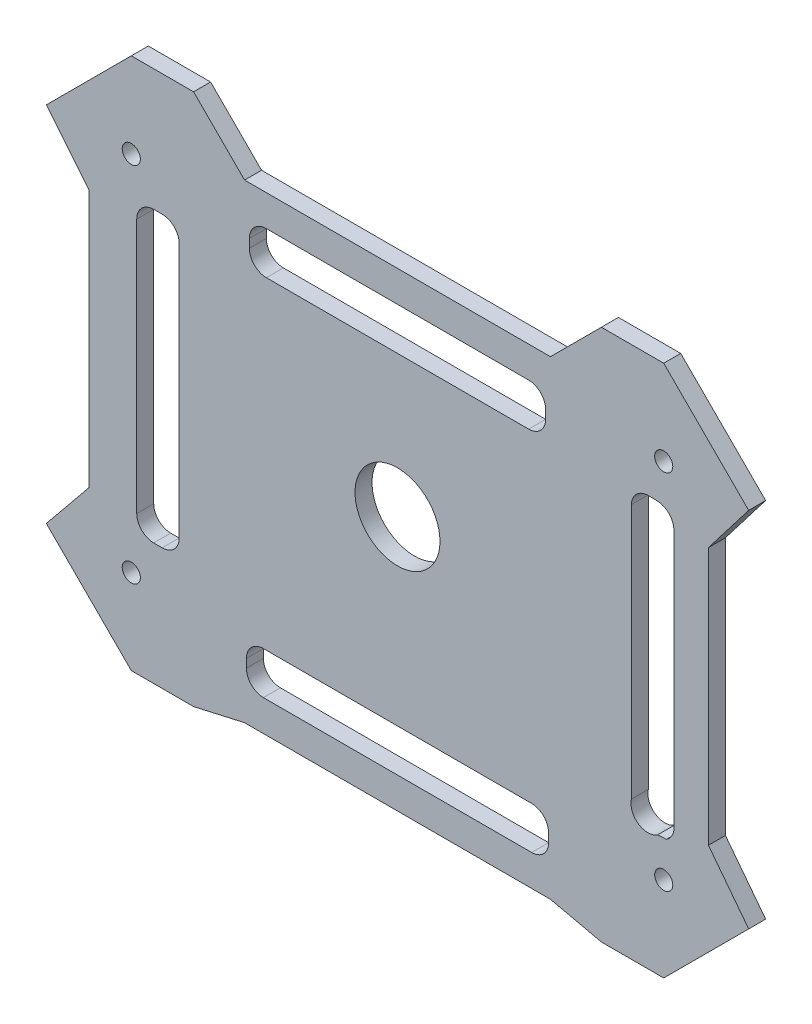
from build123d import *

# Parameters (mm, degrees)
SKETCH1_R           = 7.50000053
SKETCH1_R_2         = 1.6
BOSS_EXTRUDE1_DEPTH = 3


with BuildPart() as part:
    # Sketch1 → Boss-Extrude1 (new body)
    with BuildSketch(Plane.XY):
        Polygon((-66.89924788, 56.788402458), (-51.89924788, 71.788403422), (-40.89924788, 71.788403422), (-31.89924788, 62.788403422), (22.10075212, 62.788403422), (31.10075212, 71.788403422), (42.10075212, 71.788403422), (57.10075212, 56.788402458), (49.999134038, 47.546675265), (49.999134038, 2.030197685), (57.10075212, -7.211596578), (42.10075212, -22.211596578), (31.10075212, -22.211596578), (22.10075212, -20.180597469), (-31.89924788, -20.180597469), (-40.89924788, -22.211598699), (-51.89924788, -22.211598699), (-66.89924788, -7.211596578), (-59.371431864, 2.030197685), (-59.371431864, 47.546675265), align=None)
        with Locations((-4.89924788, 24.798725856)):
            Circle(SKETCH1_R, mode=Mode.SUBTRACT)
        with Locations((-51.89924788, 56.788403422)):
            Circle(SKETCH1_R_2, mode=Mode.SUBTRACT)
        with Locations((42.10075212, 56.788403422)):
            Circle(SKETCH1_R_2, mode=Mode.SUBTRACT)
        with Locations((42.10075212, -7.211596578)):
            Circle(SKETCH1_R_2, mode=Mode.SUBTRACT)
        with Locations((-51.89924788, -7.211596578)):
            Circle(SKETCH1_R_2, mode=Mode.SUBTRACT)
        with BuildLine():
            Line((-47.943404379, 50.293594248), (-46.443406464, 50.296157806))
            ThreePointArc((-46.443406464, 50.296157806), (-44.318775436, 49.419295137), (-43.438283518, 47.296165805))
            Line((-43.438283518, 47.296165805), (-43.438283518, 2.301285908))
            ThreePointArc((-43.438283518, 2.301285908), (-44.312414708, 0.171678429), (-46.438272777, -0.711532092))
            Line((-46.438272777, -0.711532092), (-47.938272883, -0.711532092))
            ThreePointArc((-47.938272883, -0.711532092), (-50.059593376, 0.167147627), (-50.938273095, 2.28846812))
            Line((-50.938273095, 2.28846812), (-50.938273095, 47.288471302))
            ThreePointArc((-50.938273095, 47.288471302), (-50.063220077, 49.411290395), (-47.943404379, 50.293594248))
        make_face(mode=Mode.SUBTRACT)
        with BuildLine():
            Line((-28.054738716, 57.288403953), (18.256242957, 57.288403953))
            ThreePointArc((18.256242957, 57.288403953), (20.377563451, 56.409724234), (21.256243169, 54.28840374))
            Line((21.256243169, 54.28840374), (21.256243169, 52.788403634))
            ThreePointArc((21.256243169, 52.788403634), (20.377563451, 50.667083141), (18.256242957, 49.788403422))
            Line((18.256242957, 49.788403422), (-28.054738716, 49.788403422))
            ThreePointArc((-28.054738716, 49.788403422), (-30.17605921, 50.667083141), (-31.054738929, 52.788403634))
            Line((-31.054738929, 52.788403634), (-31.054738929, 54.28840374))
            ThreePointArc((-31.054738929, 54.28840374), (-30.17605921, 56.409724234), (-28.054738716, 57.288403953))
        make_face(mode=Mode.SUBTRACT)
        with BuildLine():
            Line((40.986432116, 50.152198784), (39.487237783, 50.201358441))
            ThreePointArc((39.487237783, 50.201358441), (37.338259765, 49.392672987), (36.390529804, 47.30128909))
            Line((36.390529804, 47.30128909), (36.390529804, 2.296162622))
            ThreePointArc((36.390529804, 2.296162622), (37.63815416, -0.88414715), (41.054067708, -0.834433807))
            Line((41.054067708, -0.834433807), (42.553262041, -0.78527415))
            ThreePointArc((42.553262041, -0.78527415), (43.695191197, 0.55294834), (43.890530335, 2.301285908))
            Line((43.890530335, 2.301285908), (43.890530335, 47.30128909))
            ThreePointArc((43.890530335, 47.30128909), (42.995792019, 49.294452303), (40.986432116, 50.152198784))
        make_face(mode=Mode.SUBTRACT)
        with BuildLine():
            Line((18.778253795, -14.680597999), (-28.576749554, -14.680597999))
            ThreePointArc((-28.576749554, -14.680597999), (-30.698070048, -13.801918281), (-31.576749766, -11.680597787))
            Line((-31.576749766, -11.680597787), (-31.576749766, -10.180597681))
            ThreePointArc((-31.576749766, -10.180597681), (-30.698070048, -8.059277188), (-28.576749554, -7.180597469))
            Line((-28.576749554, -7.180597469), (18.778253795, -7.180597469))
            ThreePointArc((18.778253795, -7.180597469), (20.899574288, -8.059277188), (21.778254007, -10.180597681))
            Line((21.778254007, -10.180597681), (21.778254007, -11.680597787))
            ThreePointArc((21.778254007, -11.680597787), (20.899574288, -13.801918281), (18.778253795, -14.680597999))
        make_face(mode=Mode.SUBTRACT)
    extrude(amount=BOSS_EXTRUDE1_DEPTH)


solid = part.part
